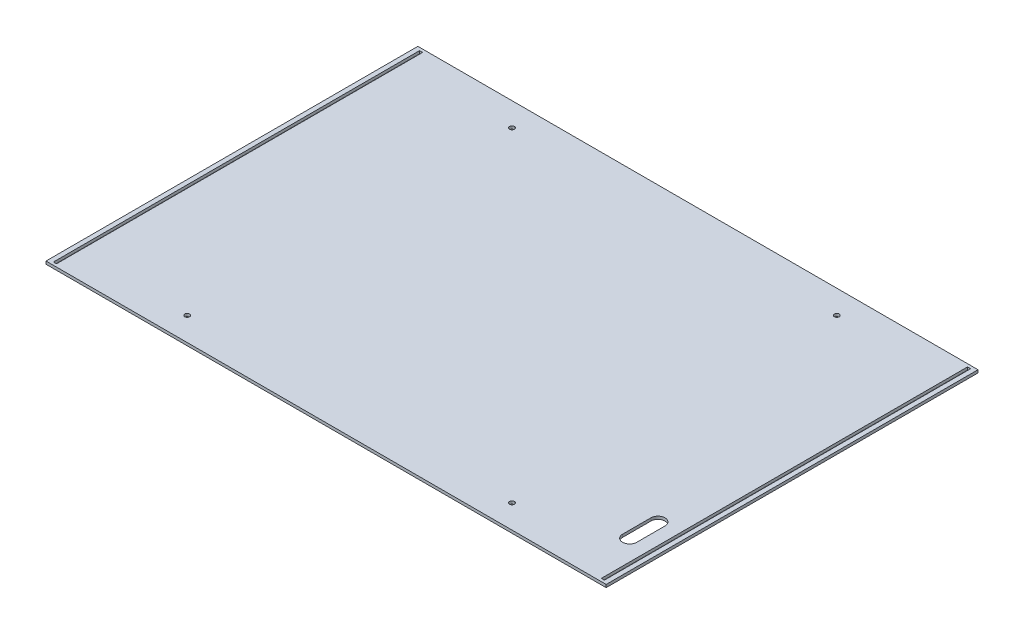
from build123d import *

# Parameters (mm, degrees)
SKETCH1_W               = 595
SKETCH1_H               = 395
BOSS_EXTRUDE1_DEPTH     = 3
CUT_EXTRUDE1_DEPTH      = 10
CUT_EXTRUDE2_DEPTH      = 358.10152618
CUT_EXTRUDE2_DEPTH_BACK = 358.10152618
SKETCH5_W               = 3.3
SKETCH5_H               = 389
CUT_EXTRUDE3_DEPTH      = 358.10152618
CUT_EXTRUDE3_DEPTH_BACK = 358.10152618
SKETCH6_R               = 2.6


with BuildPart() as part:
    # Sketch1 → Boss-Extrude1 (new body)
    with BuildSketch(Plane(origin=(0, 0, 0), x_dir=(1, 0, 0), z_dir=(0, 1, 0))):
        Rectangle(SKETCH1_W, SKETCH1_H)
    extrude(amount=BOSS_EXTRUDE1_DEPTH)

    # Sketch2 → Cut-Extrude1 (cut)
    with BuildSketch(Plane(origin=(0, 3, 0), x_dir=(1, 0, 0), z_dir=(0, 1, 0))):
        with BuildLine():
            Line((275, -112.5), (275, -142.5))
            ThreePointArc((275, -142.5), (267.5, -150), (260, -142.5))
            Line((260, -142.5), (260, -112.5))
            ThreePointArc((260, -112.5), (267.5, -105), (275, -112.5))
        make_face()
    extrude(amount=-CUT_EXTRUDE1_DEPTH, mode=Mode.SUBTRACT)

    # Sketch5 → Cut-Extrude2 (cut, two sides: drawn at the far end of the back side and taken through both)
    with BuildSketch(Plane(origin=(0, 3, 0), x_dir=(1, 0, 0), z_dir=(0, 1, 0)).offset(-CUT_EXTRUDE2_DEPTH_BACK)):
        with Locations((-291, 0)):
            Rectangle(SKETCH5_W, SKETCH5_H)
        with Locations((291, 0)):
            Rectangle(SKETCH5_W, SKETCH5_H)
    extrude(amount=CUT_EXTRUDE2_DEPTH + CUT_EXTRUDE2_DEPTH_BACK, mode=Mode.SUBTRACT)

    # Sketch6 → Cut-Extrude3 (cut, two sides: drawn at the far end of the back side and taken through both)
    with BuildSketch(Plane(origin=(0, 3, 0), x_dir=(1, 0, 0), z_dir=(0, 1, 0)).offset(-CUT_EXTRUDE3_DEPTH_BACK)):
        with Locations(Location((172.5, 172.5, 0), (0, 0, 270))):
            Circle(SKETCH6_R)
        with Locations(Location((-172.5, -172.5, 0), (0, 0, 270))):
            Circle(SKETCH6_R)
        with Locations(Location((172.5, -172.5, 0), (0, 0, 270))):
            Circle(SKETCH6_R)
        with Locations(Location((-172.5, 172.5, 0), (0, 0, 270))):
            Circle(SKETCH6_R)
    extrude(amount=CUT_EXTRUDE3_DEPTH + CUT_EXTRUDE3_DEPTH_BACK, mode=Mode.SUBTRACT)


solid = part.part
